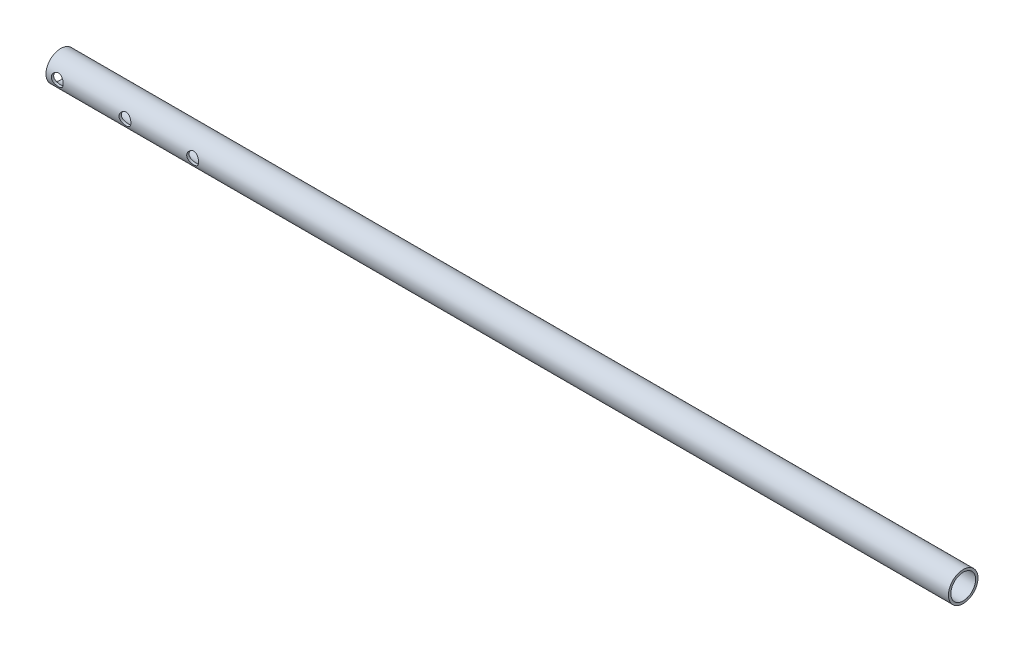
from build123d import *

# Parameters (mm, degrees)
SKETCH1_R               = 6.55
SKETCH1_R_2             = 5.5
BOSS_EXTRUDE1_DEPTH     = 400
CUT_EXTRUDE1_DEPTH      = 401.107241874
CUT_EXTRUDE1_DEPTH_BACK = 401.107241874
SKETCH2_R               = 2.625


with BuildPart() as part:
    # Sketch1 → Boss-Extrude1 (new body)
    with BuildSketch(Plane(origin=(0, 0, 0), x_dir=(0, 0, -1), z_dir=(1, 0, 0))):
        Circle(SKETCH1_R)
        Circle(SKETCH1_R_2, mode=Mode.SUBTRACT)
    extrude(amount=BOSS_EXTRUDE1_DEPTH)

    # Sketch2 → Cut-Extrude1 (cut, two sides: drawn at the far end of the back side and taken through both)
    with BuildSketch(Plane.XY.offset(-CUT_EXTRUDE1_DEPTH_BACK)):
        with Locations((5, 0)):
            Circle(SKETCH2_R)
        with Locations((35, 0)):
            Circle(SKETCH2_R)
        with Locations((65, 0)):
            Circle(SKETCH2_R)
    extrude(amount=CUT_EXTRUDE1_DEPTH + CUT_EXTRUDE1_DEPTH_BACK, mode=Mode.SUBTRACT)


solid = part.part
